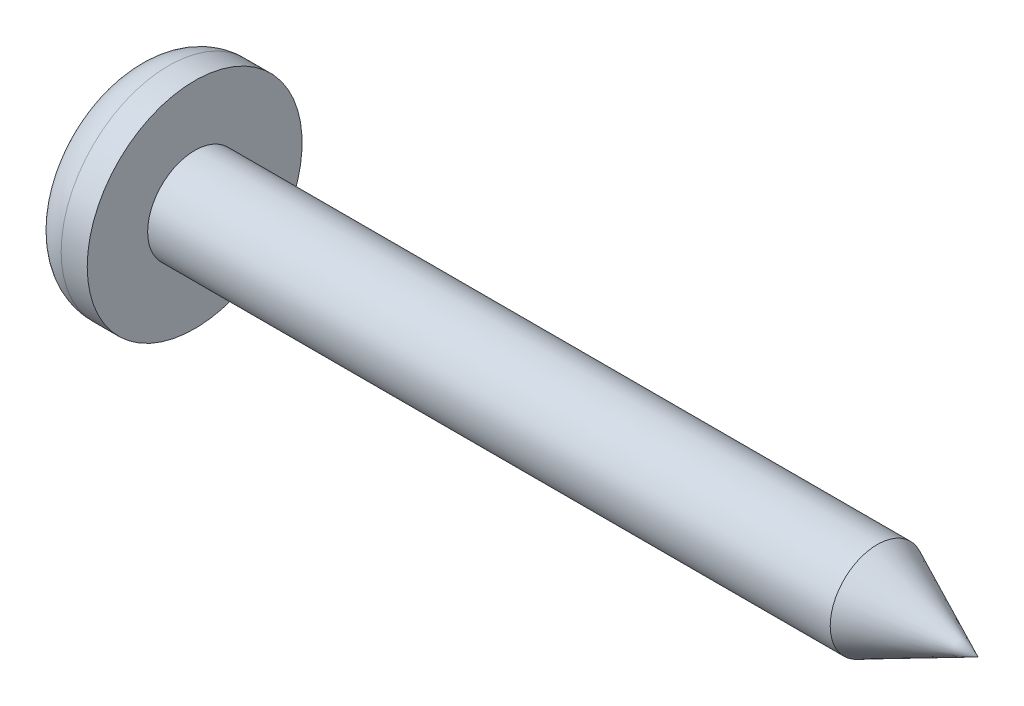
from build123d import *

# Parameters (mm, degrees)
CUT_EXTRUDE3_DEPTH         = 1.9746
DRAFT1_ANGLE               = 20
RECESSI_CUT_EXTRUDE5_DEPTH = 1.9746


with BuildPart() as part:
    # Sketch1 → base-Revolve (revolve)
    with BuildSketch(Plane.XY, mode=Mode.PRIVATE) as base_revolve_sk:
        with BuildLine():
            Line((0, 0), (0, 2.2606))
            ThreePointArc((0, 2.2606), (0.342216437, 3.086783563), (1.1684, 3.429))
            Line((1.1684, 3.429), (2, 3.429))
            Line((2, 3.429), (2, 1.5))
            Line((2, 1.5), (27, 1.5))
            Line((27, 1.5), (27, 0))
            Line((27, 0), (0, 0))
        make_face()
    revolve(base_revolve_sk.sketch.rotate(Axis((0, 0, 0), (1, 0, 0)), 90), axis=Axis((0, 0, 0), (1, 0, 0)))

    # Sketch4 → Cut-Extrude3 (cut)
    with BuildSketch(Plane(origin=(0, 0, 0), x_dir=(0, 0, -1), z_dir=(1, 0, 0))):
        Polygon((0.3556, 2.032), (-0.3556, 2.032), (-0.3556, 0.3556), (-2.032, 0.3556), (-2.032, -0.3556), (-0.3556, -0.3556), (-0.3556, -2.032), (0.3556, -2.032), (0.3556, -0.3556), (2.032, -0.3556), (2.032, 0.3556), (0.3556, 0.3556), align=None)
    extrude(amount=CUT_EXTRUDE3_DEPTH, mode=Mode.SUBTRACT)

    # Draft1
    draft1_faces = [part.faces().sort_by_distance(p)[0] for p in [
        (0.9873, 0, -2.032),
        (0.9873, -2.032, 0),
        (0.9873, 0, 2.032),
        (0.9873, 2.032, 0),
    ]]
    draft(draft1_faces, Plane(origin=(0, 0, 0), x_dir=(0, 0, -1), z_dir=(-1, 0, 0)), DRAFT1_ANGLE)

    # Sketch5 → recessI_Cut-Extrude5 (cut)
    with BuildSketch(Plane.ZY):
        Polygon((0.3556, 0.762), (0.762, 0.3556), (0.3556, 0.3556), align=None)
        Polygon((-0.3556, 0.3556), (-0.762, 0.3556), (-0.3556, 0.762), align=None)
        Polygon((-0.3556, -0.762), (-0.762, -0.3556), (-0.3556, -0.3556), align=None)
        Polygon((0.3556, -0.3556), (0.762, -0.3556), (0.3556, -0.762), align=None)
    extrude(amount=-RECESSI_CUT_EXTRUDE5_DEPTH, mode=Mode.SUBTRACT)

    # Sketch14 → point_Cut-Revolve3 (revolve, cut)
    with BuildSketch(Plane.XY, mode=Mode.PRIVATE) as point_cut_revolve3_sk:
        Polygon((27, 0), (23.783239619, 1.5), (27.184454292, 1.5), (27.184454292, 0), align=None)
    revolve(point_cut_revolve3_sk.sketch.rotate(Axis((0, 0, 0), (1, 0, 0)), 90), axis=Axis((0, 0, 0), (1, 0, 0)), mode=Mode.SUBTRACT)


solid = part.part
